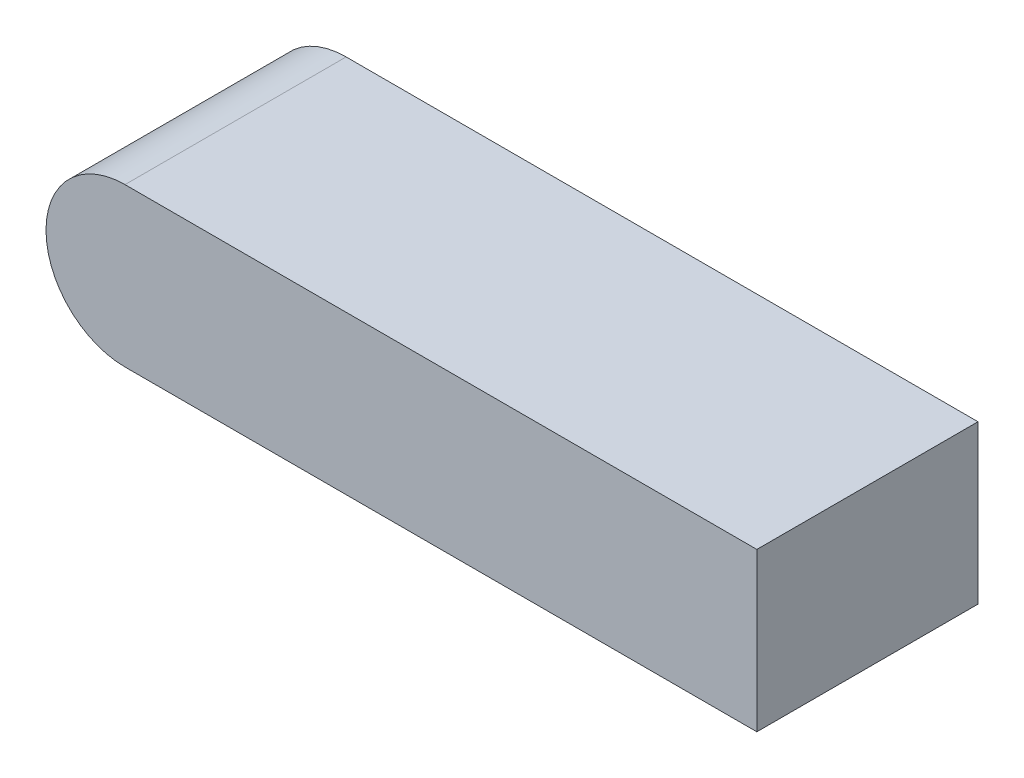
from build123d import *

# Parameters (mm, degrees)
BOSS_EXTRUDE1_DEPTH = 35


with BuildPart() as part:
    # Sketch1 → Boss-Extrude1 (new body)
    with BuildSketch(Plane.XY):
        with BuildLine():
            Line((-50, -12.5), (50, -12.5))
            Line((50, -12.5), (50, 12.5))
            Line((50, 12.5), (-50, 12.5))
            ThreePointArc((-50, 12.5), (-62.5, 0), (-50, -12.5))
        make_face()
    extrude(amount=BOSS_EXTRUDE1_DEPTH)


solid = part.part
